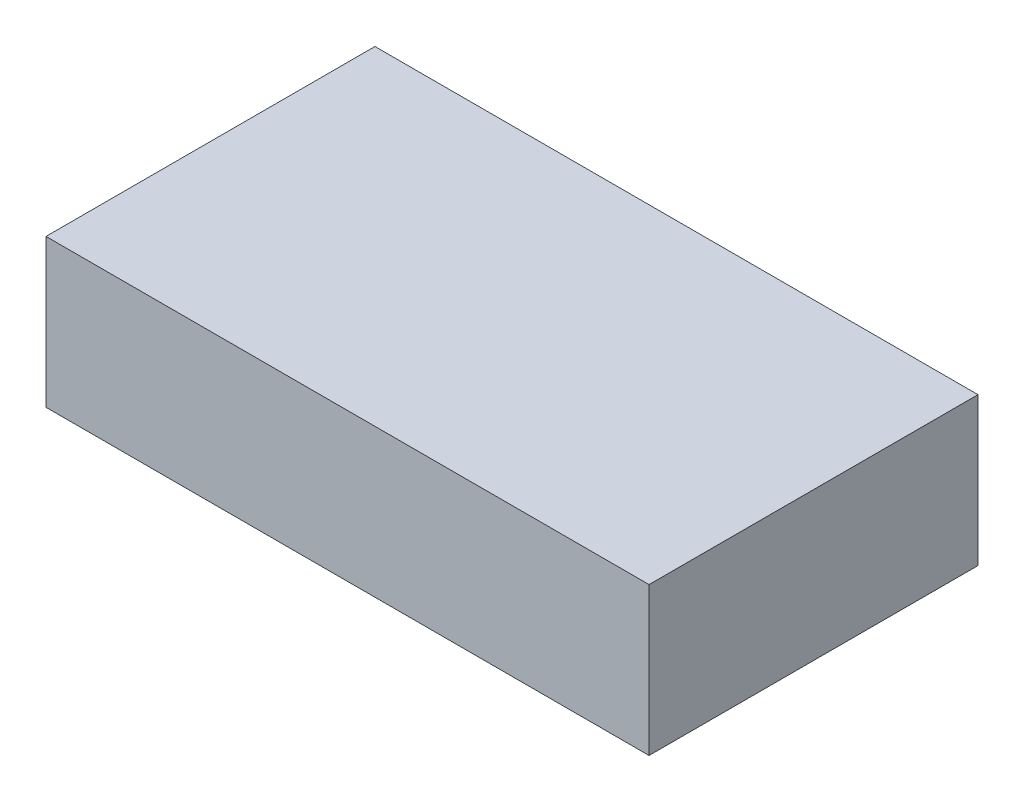
from build123d import *

# Parameters (mm, degrees)
SKETCH1_W           = 220
SKETCH1_H           = 120
BOSS_EXTRUDE1_DEPTH = 54


with BuildPart() as part:
    # Sketch1 → Boss-Extrude1 (new body)
    with BuildSketch(Plane(origin=(0, 0, 0), x_dir=(1, 0, 0), z_dir=(0, 1, 0))):
        with Locations((110, 60)):
            Rectangle(SKETCH1_W, SKETCH1_H)
    extrude(amount=BOSS_EXTRUDE1_DEPTH)


solid = part.part
